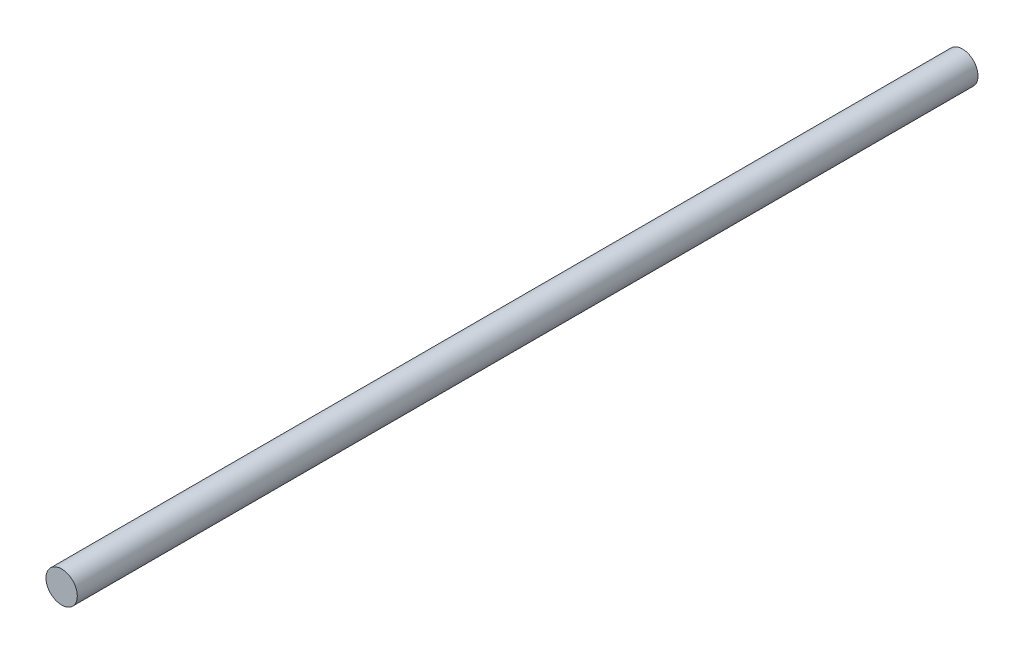
from build123d import *

# Parameters (mm, degrees)
SKETCH_1_R      = 2
EXTRUDE_1_DEPTH = 115


with BuildPart() as part:
    # 草图1 → 凸台-拉伸1 (new body)
    with BuildSketch(Plane.XY):
        Circle(SKETCH_1_R)
    extrude(amount=EXTRUDE_1_DEPTH)


solid = part.part
